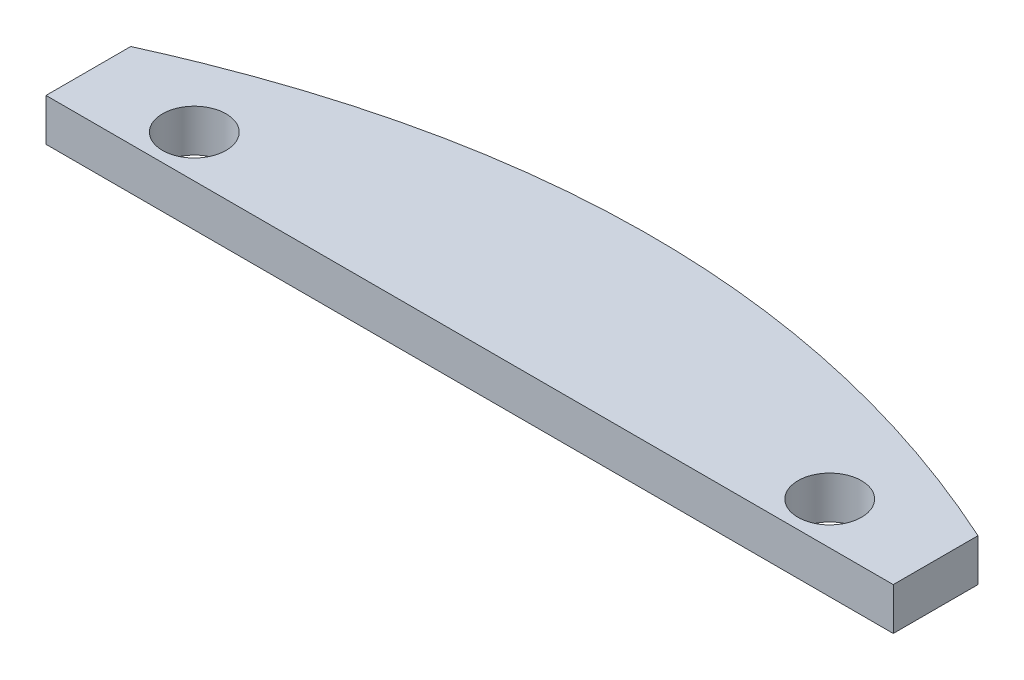
from build123d import *

# Parameters (mm, degrees)
SKETCH1_R           = 1.5
BOSS_EXTRUDE1_DEPTH = 2


with BuildPart() as part:
    # Sketch1 → Boss-Extrude1 (new body)
    with BuildSketch(Plane(origin=(0, 0, 0), x_dir=(1, 0, 0), z_dir=(0, 1, 0))):
        with BuildLine():
            Line((-16.075650118, 6.004728132), (-16.075650118, 2.004728132))
            Line((-16.075650118, 2.004728132), (23.924349882, 2.004728132))
            Line((23.924349882, 2.004728132), (23.924349882, 6.004728132))
            add(Edge.make_bspline(
                [(-16.075650118, 6.004728132), (3.924349882, 15.082742317), (23.924349882, 6.004728132)],
                knots=[0, 0, 0, 1, 1, 1], degree=2))
        make_face()
        with Locations(Location((-11.075650118, 4.004728132, 0), (0, 0, 270))):
            Circle(SKETCH1_R, mode=Mode.SUBTRACT)
        with Locations(Location((18.924349882, 4.004728132, 0), (0, 0, 90))):
            Circle(SKETCH1_R, mode=Mode.SUBTRACT)
    extrude(amount=BOSS_EXTRUDE1_DEPTH)


solid = part.part
